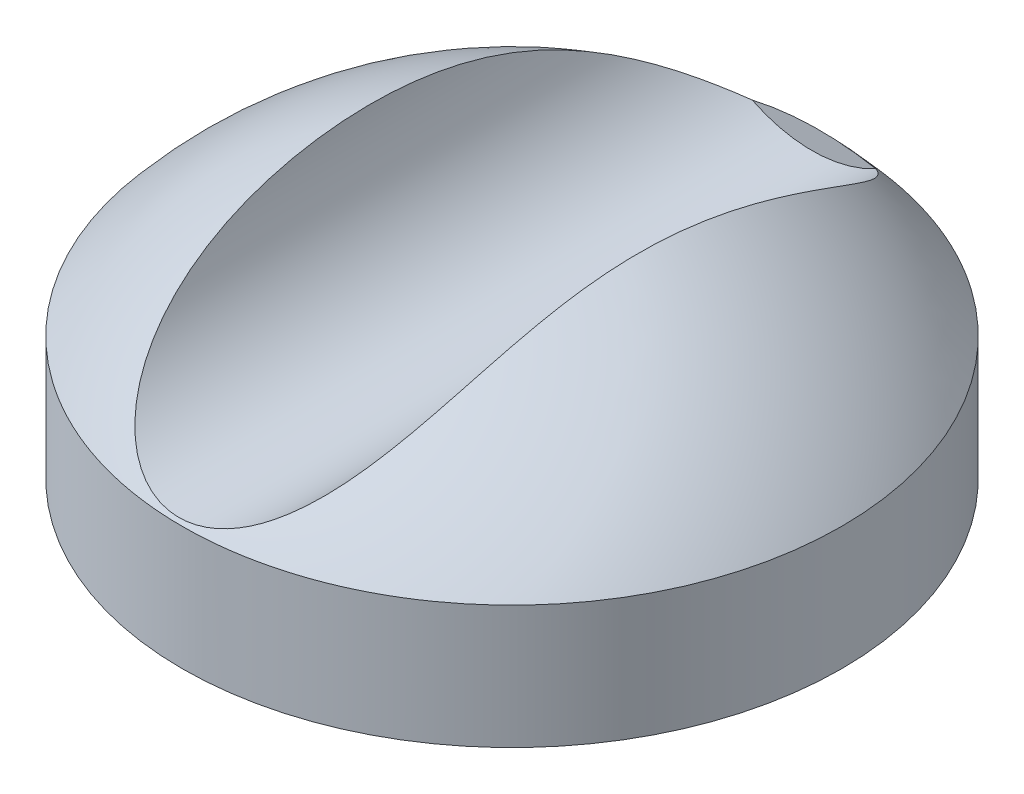
from build123d import *

# Parameters (mm, degrees)
SKETCH1_R           = 106.926704947
BOSS_EXTRUDE1_DEPTH = 40
DOME1_FACE_RADIUS   = 106.926704947
DOME1_HEIGHT        = 50
SKETCH2_W           = 5.57321272
SKETCH2_H           = 10.121090013
BOSS_EXTRUDE3_DEPTH = 0.1
SKETCH3_R           = 43.5
CUT_EXTRUDE2_DEPTH  = 250.43054033


with BuildPart() as part:
    # Sketch1 → Boss-Extrude1 (new body)
    with BuildSketch(Plane(origin=(0, 0, 0), x_dir=(1, 0, 0), z_dir=(0, 1, 0))):
        with Locations(Location((0, 0, 0), (0, 0, 270))):
            Circle(SKETCH1_R)
    extrude(amount=BOSS_EXTRUDE1_DEPTH)

    # Dome1: a dome of height H over a round flat face of radius A is a cap of a sphere of radius (A * A + H * H) / (2 * H)
    dome1_r = (DOME1_FACE_RADIUS * DOME1_FACE_RADIUS + DOME1_HEIGHT * DOME1_HEIGHT) / (2 * DOME1_HEIGHT)
    dome1_base = Plane((0, 40, 0), z_dir=(0, 1, 0))
    with Locations(dome1_base.offset(DOME1_HEIGHT - dome1_r)):
        dome1_ball = Sphere(dome1_r, mode=Mode.PRIVATE)
    add(split(dome1_ball, bisect_by=dome1_base, keep=Keep.TOP, mode=Mode.PRIVATE))

    # Sketch2 → Boss-Extrude3 (add)
    with BuildSketch(Plane(origin=(0, 0, 0), x_dir=(-1, 0, 0), z_dir=(0, -1, 0))):
        with Locations((-3.126868322, 94.609638257)):
            Rectangle(SKETCH2_W, SKETCH2_H)
    extrude(amount=BOSS_EXTRUDE3_DEPTH)

    # Sketch3 → Cut-Extrude2 (cut, through all)
    with BuildSketch(Plane(origin=(0, 0, -99.670183264), x_dir=(-1, 0, 0), z_dir=(0, 0, -1))):
        with Locations((2.431626064, 84.537651938)):
            Circle(SKETCH3_R)
    extrude(amount=-CUT_EXTRUDE2_DEPTH, mode=Mode.SUBTRACT)


solid = part.part
